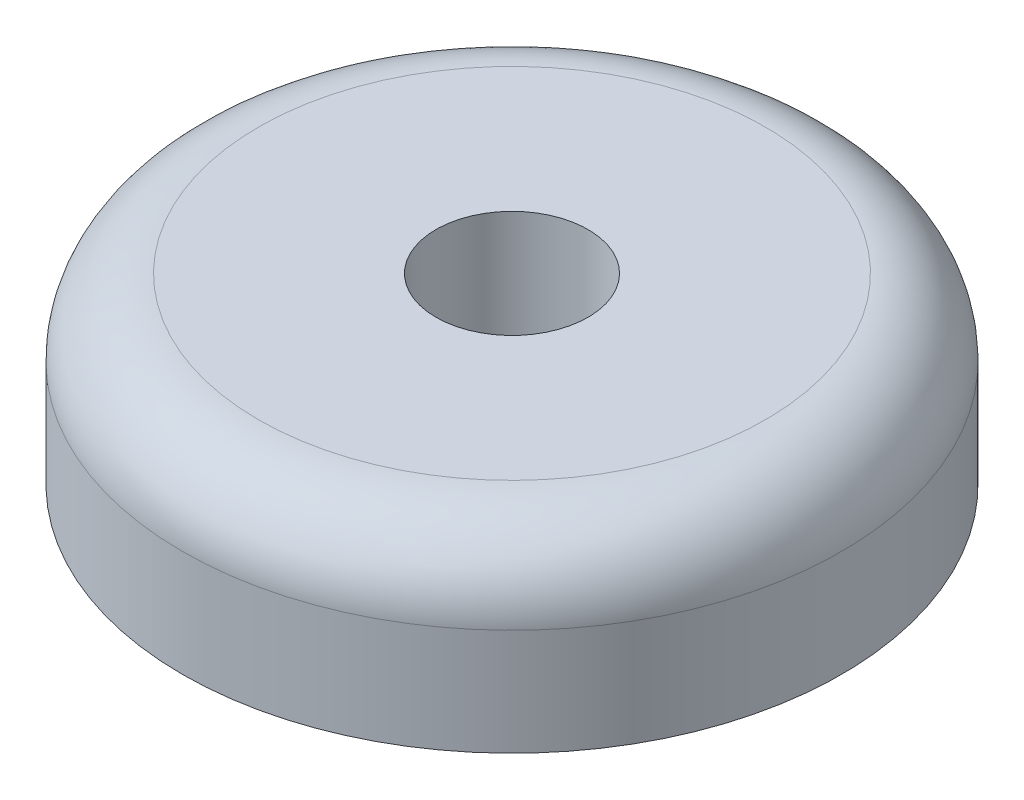
from build123d import *

# Parameters (mm, degrees)
SKETCH1_R           = 6.5
SKETCH1_R_2         = 1.5
BOSS_EXTRUDE1_DEPTH = 3.6
FILLET2_R           = 1.5


with BuildPart() as part:
    # Sketch1 → Boss-Extrude1 (new body)
    with BuildSketch(Plane(origin=(0, 0, 0), x_dir=(1, 0, 0), z_dir=(0, 1, 0))):
        with Locations(Location((0, 0, 0), (0, 0, 270))):
            Circle(SKETCH1_R)
        with Locations(Location((0, 0, 0), (0, 0, 270))):
            Circle(SKETCH1_R_2, mode=Mode.SUBTRACT)
    extrude(amount=BOSS_EXTRUDE1_DEPTH)

    # Fillet2
    fillet2_edges = [part.edges().sort_by_distance(p)[0] for p in [
        (0, 3.6, -6.5),
    ]]
    fillet(fillet2_edges, radius=FILLET2_R)


solid = part.part
